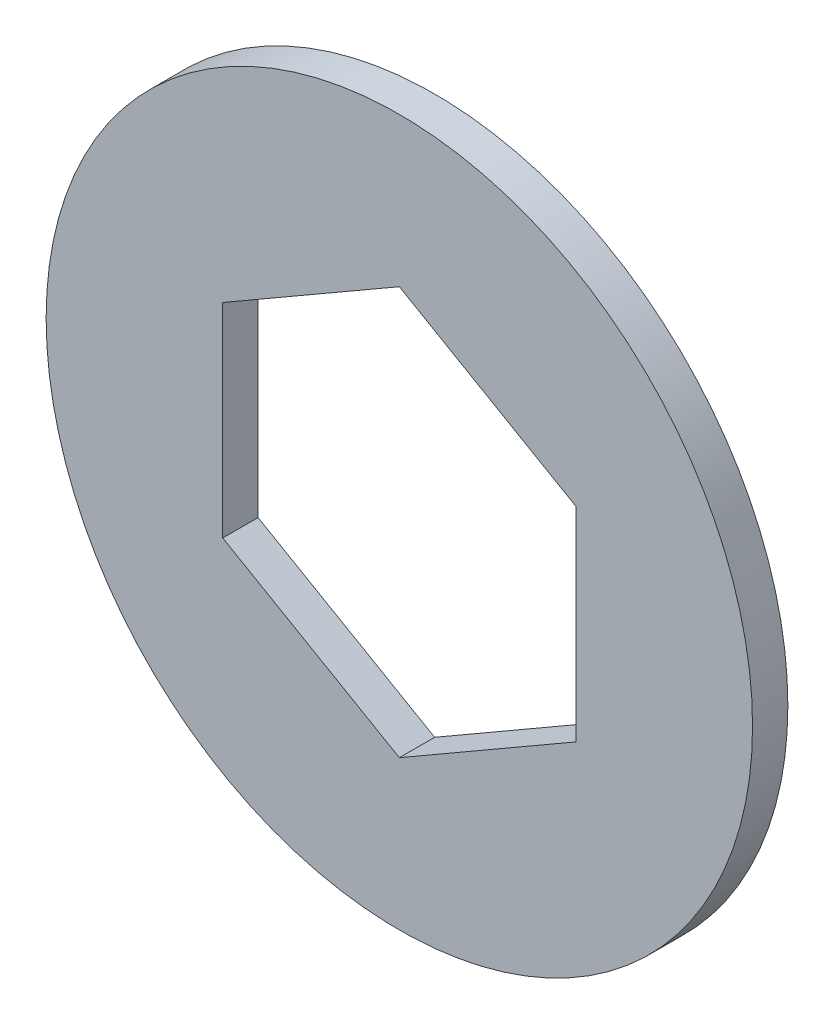
from build123d import *

# Parameters (mm, degrees)
SKETCH1_R           = 50
BOSS_EXTRUDE1_DEPTH = 5


with BuildPart() as part:
    # Sketch1 → Boss-Extrude1 (new body)
    with BuildSketch(Plane.XY):
        Circle(SKETCH1_R)
        Polygon((0, 28.867513459), (-25, 14.43375673), (-25, -14.43375673), (0, -28.867513459), (25, -14.43375673), (25, 14.43375673), align=None, mode=Mode.SUBTRACT)
    extrude(amount=BOSS_EXTRUDE1_DEPTH)


solid = part.part
